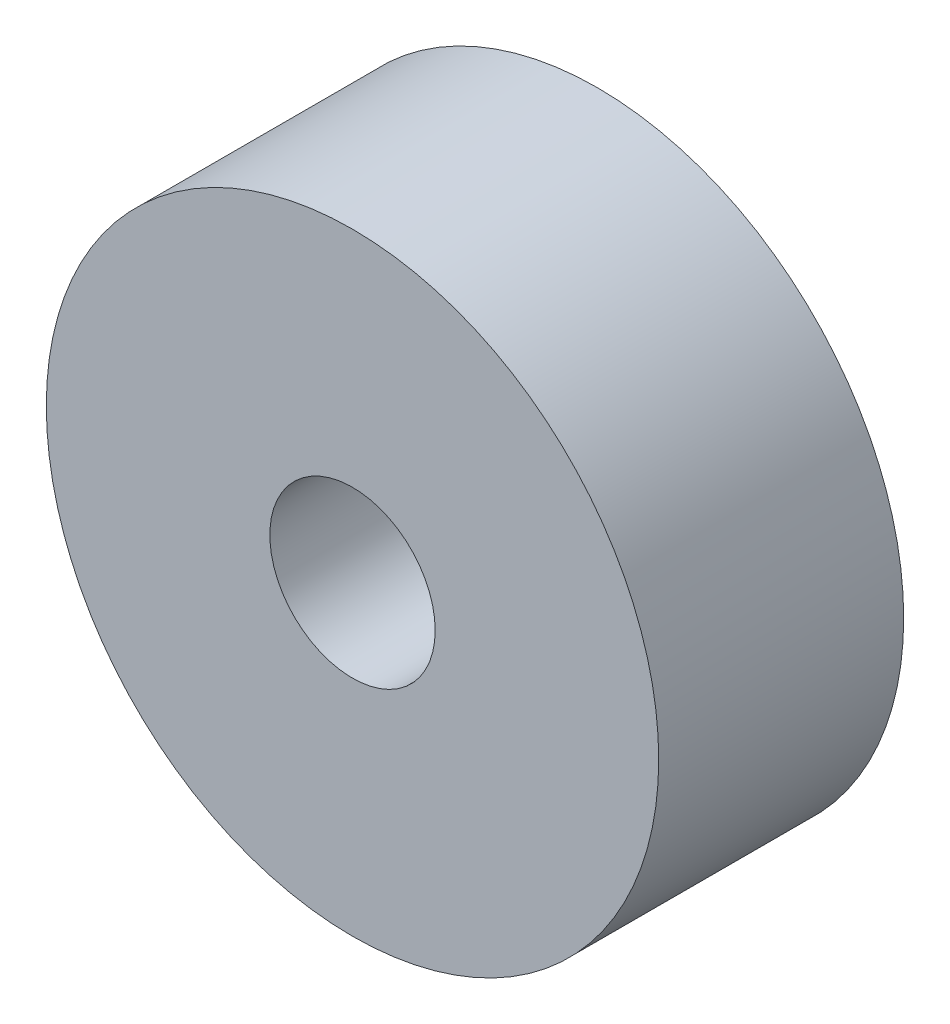
from build123d import *

# Parameters (mm, degrees)
SKETCH1_R           = 25
SKETCH1_R_2         = 6.75
BOSS_EXTRUDE1_DEPTH = 20


with BuildPart() as part:
    # Sketch1 → Boss-Extrude1 (new body)
    with BuildSketch(Plane.XY):
        Circle(SKETCH1_R)
        Circle(SKETCH1_R_2, mode=Mode.SUBTRACT)
    extrude(amount=BOSS_EXTRUDE1_DEPTH)


solid = part.part
